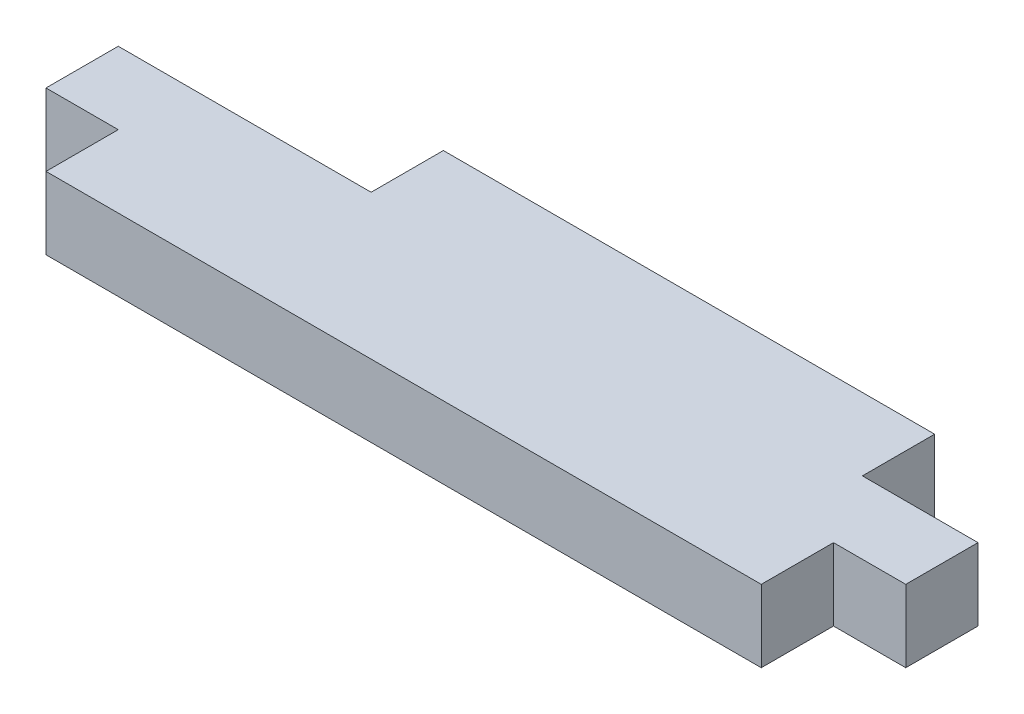
from build123d import *

# Parameters (mm, degrees)
SKETCH1_W           = 59.5
SKETCH1_H           = 5
BOSS_EXTRUDE1_DEPTH = 5
SKETCH2_W           = 49.5
SKETCH2_H           = 5
BOSS_EXTRUDE2_DEPTH = 5
SKETCH3_W           = 34
SKETCH3_H           = 5
BOSS_EXTRUDE3_DEPTH = 5


with BuildPart() as part:
    # Sketch1 → Boss-Extrude1 (new body)
    with BuildSketch(Plane.XY):
        with Locations((58.644042166, -123.5)):
            Rectangle(SKETCH1_W, SKETCH1_H)
    extrude(amount=BOSS_EXTRUDE1_DEPTH)

    # Sketch2 → Boss-Extrude2 (add)
    with BuildSketch(Plane.XY.offset(5)):
        with Locations((58.644042166, -123.5)):
            Rectangle(SKETCH2_W, SKETCH2_H)
    extrude(amount=BOSS_EXTRUDE2_DEPTH)

    # Sketch3 → Boss-Extrude3 (add)
    with BuildSketch(Plane(origin=(0, 0, 0), x_dir=(-1, 0, 0), z_dir=(0, 0, -1))):
        with Locations((-63.394042166, -123.5)):
            Rectangle(SKETCH3_W, SKETCH3_H)
    extrude(amount=BOSS_EXTRUDE3_DEPTH)


solid = part.part
